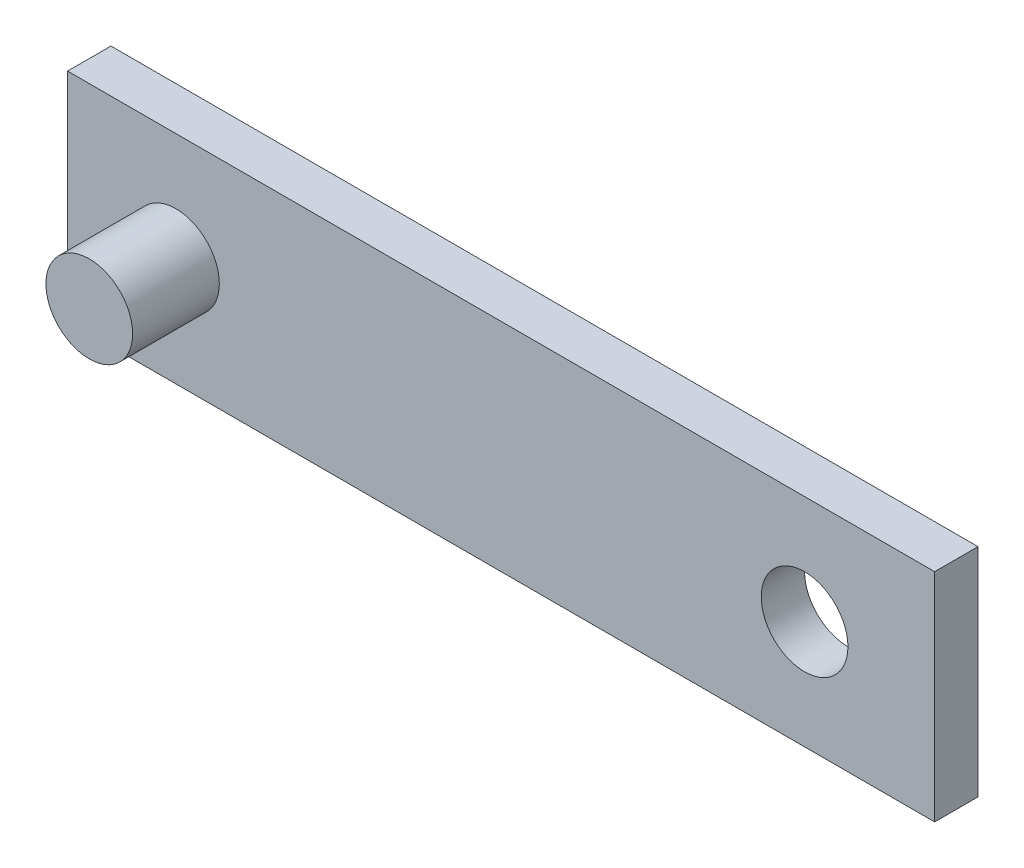
from build123d import *

# Parameters (mm, degrees)
SKETCH1_W           = 100
SKETCH1_H           = 25
SKETCH1_R           = 5
BOSS_EXTRUDE1_DEPTH = 5
SKETCH2_R           = 5
BOSS_EXTRUDE2_DEPTH = 10


with BuildPart() as part:
    # Sketch1 → Boss-Extrude1 (new body)
    with BuildSketch(Plane.XY):
        with Locations((-50, 12.5)):
            Rectangle(SKETCH1_W, SKETCH1_H)
        with Locations((-15, 12.5)):
            Circle(SKETCH1_R, mode=Mode.SUBTRACT)
    extrude(amount=BOSS_EXTRUDE1_DEPTH)

    # Sketch2 → Boss-Extrude2 (add)
    with BuildSketch(Plane.XY.offset(5)):
        with Locations((-87.5, 12.5)):
            Circle(SKETCH2_R)
    extrude(amount=BOSS_EXTRUDE2_DEPTH)


solid = part.part
